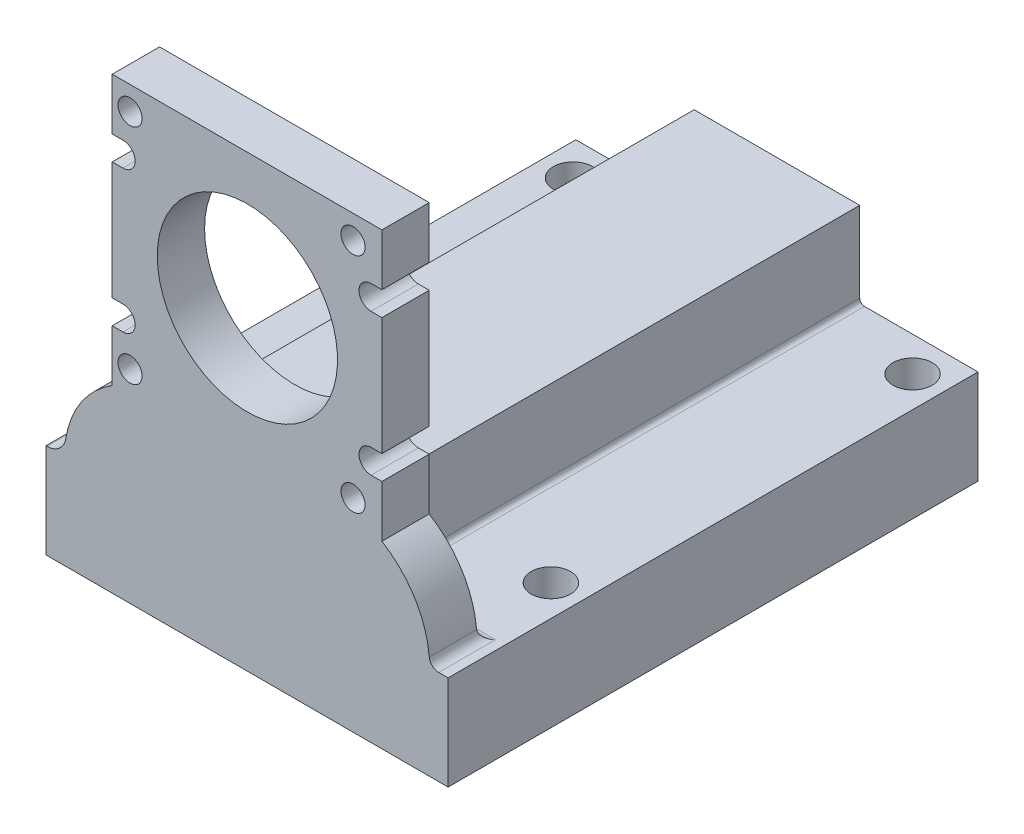
from build123d import *

# Parameters (mm, degrees)
SKETCH3_W           = 57
SKETCH3_H           = 57
BOSS_EXTRUDE1_DEPTH = 10
SKETCH3_3_R         = 2.55
CUT_EXTRUDE1_DEPTH  = 10
BOSS_EXTRUDE2_DEPTH = 112
SKETCH4_R           = 19.05
CUT_EXTRUDE2_DEPTH  = 129.967050055
SKETCH5_R           = 4.15
CUT_EXTRUDE5_DEPTH  = 142.333824685
BOSS_EXTRUDE3_DEPTH = 10
FILLET2_R           = 4
FILLET3_R           = 2
FILLET4_R           = 1


with BuildPart() as part:
    # Sketch3 → Boss-Extrude1 (new body)
    with BuildSketch(Plane.XY):
        Rectangle(SKETCH3_W, SKETCH3_H)
    extrude(amount=-BOSS_EXTRUDE1_DEPTH)

    # Sketch3<3> → Cut-Extrude1 (cut)
    with BuildSketch(Plane.XY):
        with Locations((-24.737446492, 23.520851333)):
            Circle(SKETCH3_3_R)
        with Locations((22.402553508, 23.520851333)):
            Circle(SKETCH3_3_R)
        with Locations((22.402553508, -23.619148667)):
            Circle(SKETCH3_3_R)
        with Locations((-24.737446492, -23.619148667)):
            Circle(SKETCH3_3_R)
        with BuildLine():
            Line((26.210614643, 17.55), (28.5, 17.55))
            Line((28.5, 17.55), (28.5, 12.45))
            Line((28.5, 12.45), (26.210614643, 12.45))
            ThreePointArc((26.210614643, 12.45), (23.660614643, 15), (26.210614643, 17.55))
        make_face()
        with BuildLine():
            Line((26.210614643, -12.45), (28.5, -12.45))
            Line((28.5, -12.45), (28.5, -17.55))
            Line((28.5, -17.55), (26.210614643, -17.55))
            ThreePointArc((26.210614643, -17.55), (23.660614643, -15), (26.210614643, -12.45))
        make_face()
        with BuildLine():
            Line((-26.210614643, -12.45), (-28.5, -12.45))
            Line((-28.5, -12.45), (-28.5, -17.55))
            Line((-28.5, -17.55), (-26.210614643, -17.55))
            ThreePointArc((-26.210614643, -17.55), (-23.660614643, -15), (-26.210614643, -12.45))
        make_face()
        with BuildLine():
            Line((-26.210614643, 17.55), (-28.5, 17.55))
            Line((-28.5, 17.55), (-28.5, 12.45))
            Line((-28.5, 12.45), (-26.210614643, 12.45))
            ThreePointArc((-26.210614643, 12.45), (-23.660614643, 15), (-26.210614643, 17.55))
        make_face()
    extrude(amount=-CUT_EXTRUDE1_DEPTH, mode=Mode.SUBTRACT)

    # Sketch3<4> → Boss-Extrude2 (add)
    with BuildSketch(Plane.XY):
        Polygon((17.5, -46.5), (17.5, -28.5), (-17.5, -28.5), (-17.5, -46.5), (-42.5, -46.5), (-42.5, -66.5), (42.5, -66.5), (42.5, -46.5), align=None)
    extrude(amount=-BOSS_EXTRUDE2_DEPTH)

    # Sketch4 → Cut-Extrude2 (cut, through all)
    with BuildSketch(Plane(origin=(0, 0, -10), x_dir=(-1, 0, 0), z_dir=(0, 0, -1))):
        with Locations((-0.070866951, -0.007657079)):
            Circle(SKETCH4_R)
    extrude(amount=-CUT_EXTRUDE2_DEPTH, mode=Mode.SUBTRACT)

    # Sketch5 → Cut-Extrude5 (cut, through all)
    with BuildSketch(Plane(origin=(0, -46.5, 0), x_dir=(1, 0, 0), z_dir=(0, 1, 0))):
        with Locations((35.955648409, 104.71127815)):
            Circle(SKETCH5_R)
        with Locations((35.955648409, 28.261929333)):
            Circle(SKETCH5_R)
        with Locations((-35.821593513, 28.261929333)):
            Circle(SKETCH5_R)
        with Locations((-35.821593513, 104.71127815)):
            Circle(SKETCH5_R)
    extrude(amount=-CUT_EXTRUDE5_DEPTH, mode=Mode.SUBTRACT)

    # Sketch6 → Boss-Extrude3 (add)
    with BuildSketch(Plane.XY):
        with BuildLine():
            Line((-17.5, -28.5), (-28.5, -28.5))
            ThreePointArc((-28.5, -28.5), (-35.898984404, -36.181212625), (-38.59502311, -46.5))
            Line((-38.59502311, -46.5), (-17.5, -46.5))
            Line((-17.5, -46.5), (-17.5, -28.5))
        make_face()
        with BuildLine():
            Line((17.5, -28.5), (17.5, -46.5))
            Line((17.5, -46.5), (38.59502311, -46.5))
            ThreePointArc((38.59502311, -46.5), (35.898984404, -36.181212625), (28.5, -28.5))
            Line((28.5, -28.5), (17.5, -28.5))
        make_face()
    extrude(amount=-BOSS_EXTRUDE3_DEPTH)

    # Fillet2
    fillet2_edges = [part.edges().sort_by_distance(p)[0] for p in [
        (-28.047511555, -46.5, -10),
        (-38.59502311, -46.5, -5),
    ]]
    fillet(fillet2_edges, radius=FILLET2_R)

    # Fillet3
    fillet3_edges = [part.edges().sort_by_distance(p)[0] for p in [
        (38.59502311, -46.5, -5),
        (28.047511555, -46.5, -10),
    ]]
    fillet(fillet3_edges, radius=FILLET3_R)

    # Fillet4
    fillet4_edges = [part.edges().sort_by_distance(p)[0] for p in [
        (-17.5, -35.5, -10),
        (17.5, -36.5, -10),
        (0, -28.5, -10),
    ]]
    fillet(fillet4_edges, radius=FILLET4_R)


solid = part.part
